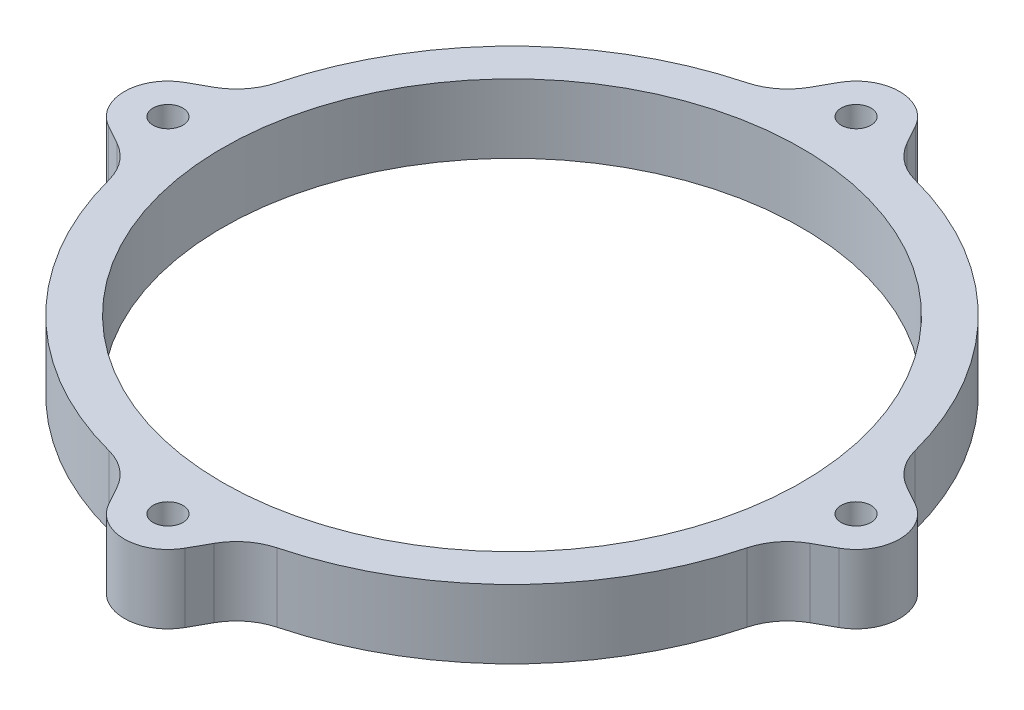
from build123d import *

# Parameters (mm, degrees)
SKETCH_1_R      = 50.5
SKETCH_1_R_2    = 2.6
EXTRUDE_1_DEPTH = 12
FILLET_1_R      = 10


with BuildPart() as part:
    # ｽｹｯﾁ1 → ﾎﾞｽ - 押し出し1 (new body)
    with BuildSketch(Plane(origin=(0, 0, 0), x_dir=(1, 0, 0), z_dir=(0, 1, 0))):
        with BuildLine():
            Line((-6.641105235, 63.695364835), (-10.641105235, 56.506786136))
            ThreePointArc((-10.641105235, 56.506786136), (-40.658639918, 40.658639918), (-56.506786136, 10.641105235))
            Line((-56.506786136, 10.641105235), (-63.695364835, 6.641105235))
            ThreePointArc((-63.695364835, 6.641105235), (-67.6, 0), (-63.695364835, -6.641105235))
            Line((-63.695364835, -6.641105235), (-56.506786136, -10.641105235))
            ThreePointArc((-56.506786136, -10.641105235), (-40.658639918, -40.658639918), (-10.641105235, -56.506786136))
            Line((-10.641105235, -56.506786136), (-6.641105235, -63.695364835))
            ThreePointArc((-6.641105235, -63.695364835), (0, -67.6), (6.641105235, -63.695364835))
            Line((6.641105235, -63.695364835), (10.641105235, -56.506786136))
            ThreePointArc((10.641105235, -56.506786136), (40.658639918, -40.658639918), (56.506786136, -10.641105235))
            Line((56.506786136, -10.641105235), (63.695364835, -6.641105235))
            ThreePointArc((63.695364835, -6.641105235), (67.6, 0), (63.695364835, 6.641105235))
            Line((63.695364835, 6.641105235), (56.506786136, 10.641105235))
            ThreePointArc((56.506786136, 10.641105235), (40.658639918, 40.658639918), (10.641105235, 56.506786136))
            Line((10.641105235, 56.506786136), (6.641105235, 63.695364835))
            ThreePointArc((6.641105235, 63.695364835), (0, 67.6), (-6.641105235, 63.695364835))
        make_face()
        with Locations(Location((0, 0, 0), (0, 0, 270))):
            Circle(SKETCH_1_R, mode=Mode.SUBTRACT)
        with Locations(Location((0, 60, 0), (0, 0, 270))):
            Circle(SKETCH_1_R_2, mode=Mode.SUBTRACT)
        with Locations(Location((60, 0, 0), (0, 0, 270))):
            Circle(SKETCH_1_R_2, mode=Mode.SUBTRACT)
        with Locations(Location((0, -60, 0), (0, 0, 270))):
            Circle(SKETCH_1_R_2, mode=Mode.SUBTRACT)
        with Locations(Location((-60, 0, 0), (0, 0, 270))):
            Circle(SKETCH_1_R_2, mode=Mode.SUBTRACT)
    extrude(amount=EXTRUDE_1_DEPTH)

    # ﾌｨﾚｯﾄ1
    fillet_1_edges = [part.edges().sort_by_distance(p)[0] for p in [
        (10.641105235, 6, -56.506786136),
        (56.506786136, 6, -10.641105235),
        (56.506786136, 6, 10.641105235),
        (10.641105235, 6, 56.506786136),
        (-10.641105235, 6, 56.506786136),
        (-56.506786136, 6, 10.641105235),
        (-56.506786136, 6, -10.641105235),
        (-10.641105235, 6, -56.506786136),
    ]]
    fillet(fillet_1_edges, radius=FILLET_1_R)


solid = part.part
